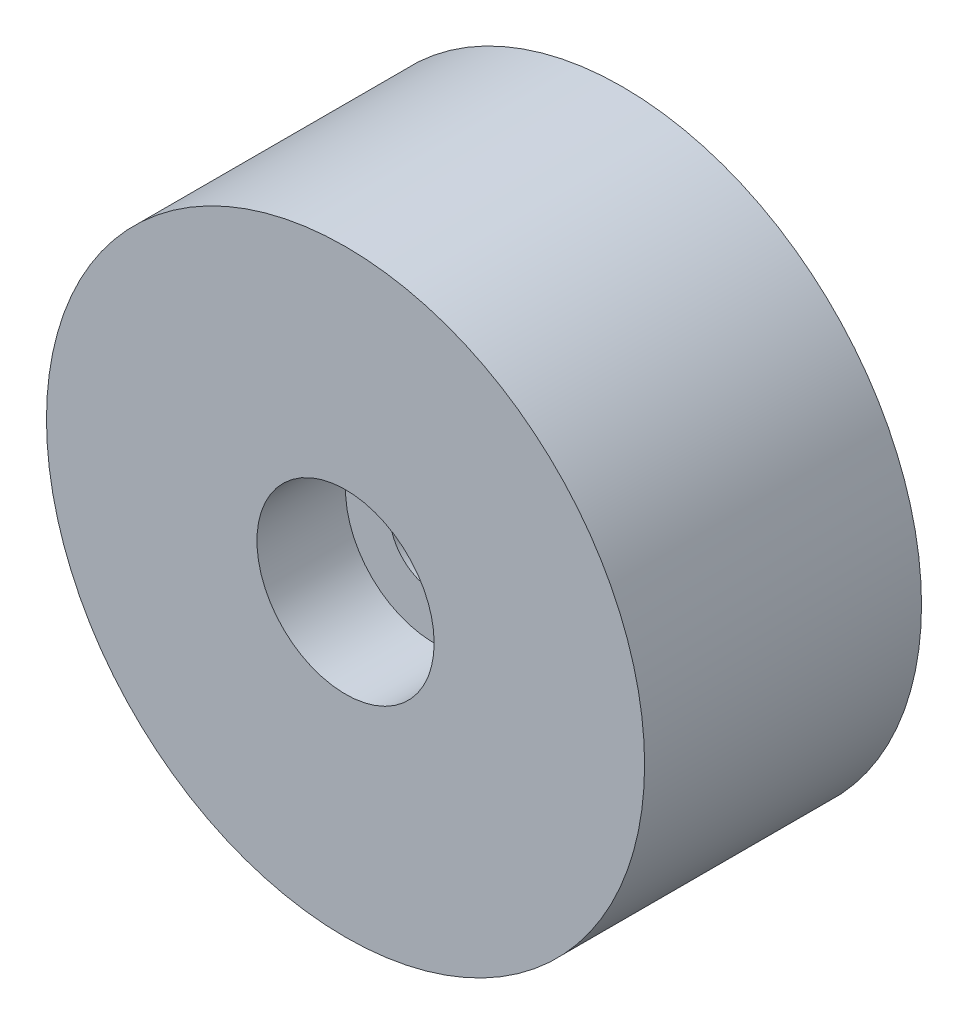
from build123d import *

# Parameters (mm, degrees)
ESQUISSE1_R             = 27
BOSS_EXTRU_1_DEPTH      = 25
ESQUISSE2_R             = 8
ENL_V_MAT_EXTRU_1_DEPTH = 8
ESQUISSE3_R             = 4
ENL_V_MAT_EXTRU_2_DEPTH = 42.797129088


with BuildPart() as part:
    # Esquisse1 → Boss.-Extru.1 (new body)
    with BuildSketch(Plane.XY):
        Circle(ESQUISSE1_R)
    extrude(amount=BOSS_EXTRU_1_DEPTH)

    # Esquisse2 → Enlèv. mat.-Extru.1 (cut)
    with BuildSketch(Plane.XY.offset(25)):
        Circle(ESQUISSE2_R)
    extrude(amount=-ENL_V_MAT_EXTRU_1_DEPTH, mode=Mode.SUBTRACT)

    # Esquisse3 → Enlèv. mat.-Extru.2 (cut, through all)
    with BuildSketch(Plane.XY.offset(17)):
        Circle(ESQUISSE3_R)
    extrude(amount=-ENL_V_MAT_EXTRU_2_DEPTH, mode=Mode.SUBTRACT)


solid = part.part
